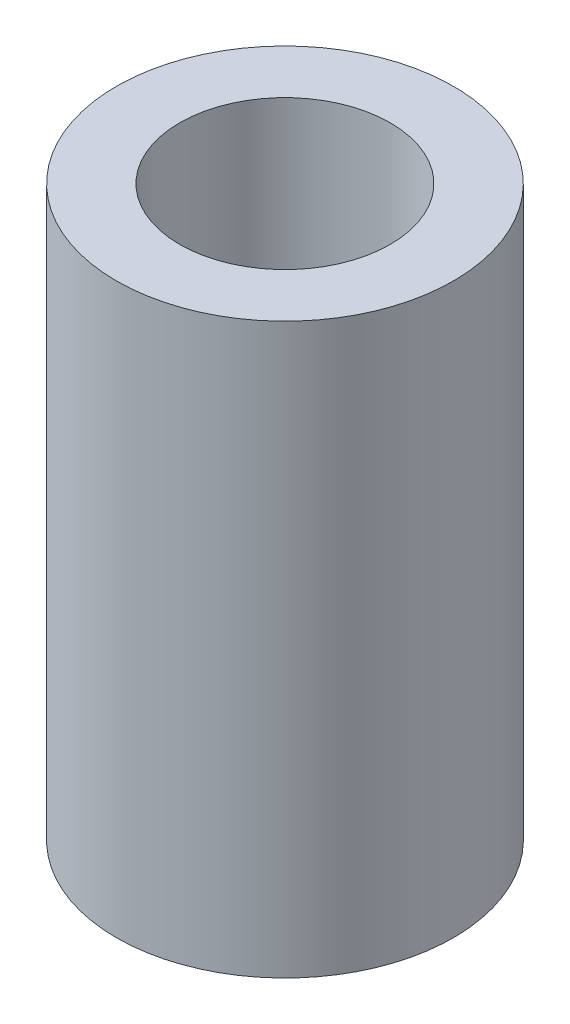
from build123d import *

# Parameters (mm, degrees)
SKETCH_1_R      = 4
SKETCH_1_R_2    = 2.5
EXTRUDE_1_DEPTH = 13.5


with BuildPart() as part:
    # 草图1 → 凸台-拉伸1 (new body)
    with BuildSketch(Plane(origin=(0, 0, 0), x_dir=(1, 0, 0), z_dir=(0, 1, 0))):
        with Locations(Location((0, 0, 0), (0, 0, 270))):
            Circle(SKETCH_1_R)
        with Locations(Location((0, 0, 0), (0, 0, 270))):
            Circle(SKETCH_1_R_2, mode=Mode.SUBTRACT)
    extrude(amount=EXTRUDE_1_DEPTH)


solid = part.part
